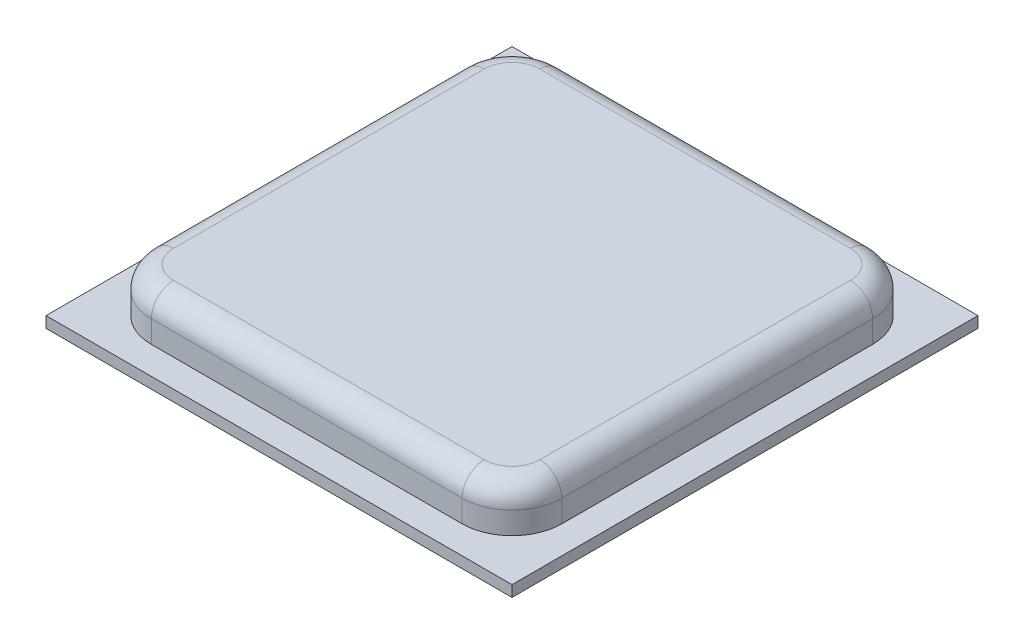
from build123d import *

# Parameters (mm, degrees)
SKETCH1_W           = 42
SKETCH1_H           = 42
BOSS_EXTRUDE1_DEPTH = 1
BOSS_EXTRUDE2_DEPTH = 5
FILLET1_R           = 2


with BuildPart() as part:
    # Sketch1 → Boss-Extrude1 (new body)
    with BuildSketch(Plane(origin=(0, 0, 0), x_dir=(1, 0, 0), z_dir=(0, 1, 0))):
        Rectangle(SKETCH1_W, SKETCH1_H)
        with BuildLine():
            Line((-14, -18.5), (14, -18.5))
            ThreePointArc((14, -18.5), (17.181980515, -17.181980515), (18.5, -14))
            Line((18.5, -14), (18.5, 14))
            ThreePointArc((18.5, 14), (17.181980515, 17.181980515), (14, 18.5))
            Line((14, 18.5), (-14, 18.5))
            ThreePointArc((-14, 18.5), (-17.181980515, 17.181980515), (-18.5, 14))
            Line((-18.5, 14), (-18.5, -14))
            ThreePointArc((-18.5, -14), (-17.181980515, -17.181980515), (-14, -18.5))
        make_face(mode=Mode.SUBTRACT)
    extrude(amount=BOSS_EXTRUDE1_DEPTH)

    # Sketch1<2> → Boss-Extrude2 (add)
    with BuildSketch(Plane(origin=(0, 0, 0), x_dir=(1, 0, 0), z_dir=(0, 1, 0))):
        with BuildLine():
            ThreePointArc((-18.5, -14), (-17.181980515, -17.181980515), (-14, -18.5))
            Line((-14, -18.5), (14, -18.5))
            ThreePointArc((14, -18.5), (17.181980515, -17.181980515), (18.5, -14))
            Line((18.5, -14), (18.5, 14))
            ThreePointArc((18.5, 14), (17.181980515, 17.181980515), (14, 18.5))
            Line((14, 18.5), (-14, 18.5))
            ThreePointArc((-14, 18.5), (-17.181980515, 17.181980515), (-18.5, 14))
            Line((-18.5, 14), (-18.5, -14))
        make_face()
    extrude(amount=BOSS_EXTRUDE2_DEPTH)

    # Fillet1
    fillet1_edges = [part.edges().sort_by_distance(p)[0] for p in [
        (17.181980515, 5, 17.181980515),
        (0, 5, 18.5),
        (-17.181980515, 5, 17.181980515),
        (-18.5, 5, 0),
        (-17.181980515, 5, -17.181980515),
        (0, 5, -18.5),
        (17.181980515, 5, -17.181980515),
        (18.5, 5, 0),
    ]]
    fillet(fillet1_edges, radius=FILLET1_R)


solid = part.part
